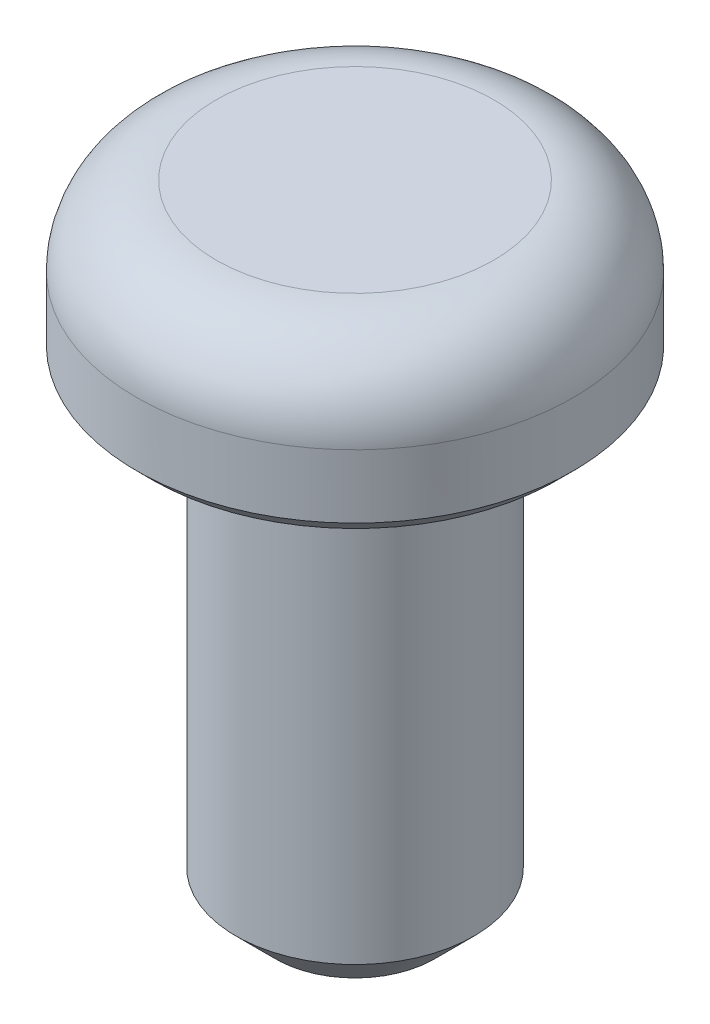
from build123d import *

# Parameters (mm, degrees)
FILLET1_R     = 1
CHAMFER1_SIZE = 0.5
CHAMFER2_SIZE = 0.2


with BuildPart() as part:
    # Sketch1 → Revolve1 (revolve)
    with BuildSketch(Plane.XY, mode=Mode.PRIVATE) as revolve1_sk:
        Polygon((0, 0), (0, 8), (2.75, 8), (2.75, 6), (1.5, 6), (1.5, 0), align=None)
    revolve(revolve1_sk.sketch.rotate(Axis((0, 0, 0), (0, 1, 0)), 90), axis=Axis((0, 0, 0), (0, 1, 0)))

    # Fillet1
    fillet1_edges = [part.edges().sort_by_distance(p)[0] for p in [
        (0, 8, 2.75),
    ]]
    fillet(fillet1_edges, radius=FILLET1_R)

    # Chamfer1
    chamfer1_edges = [part.edges().sort_by_distance(p)[0] for p in [
        (0, 0, 1.5),
    ]]
    chamfer(chamfer1_edges, length=CHAMFER1_SIZE)

    # Chamfer2
    chamfer2_edges = [part.edges().sort_by_distance(p)[0] for p in [
        (0, 6, 2.75),
    ]]
    chamfer(chamfer2_edges, length=CHAMFER2_SIZE)


solid = part.part
